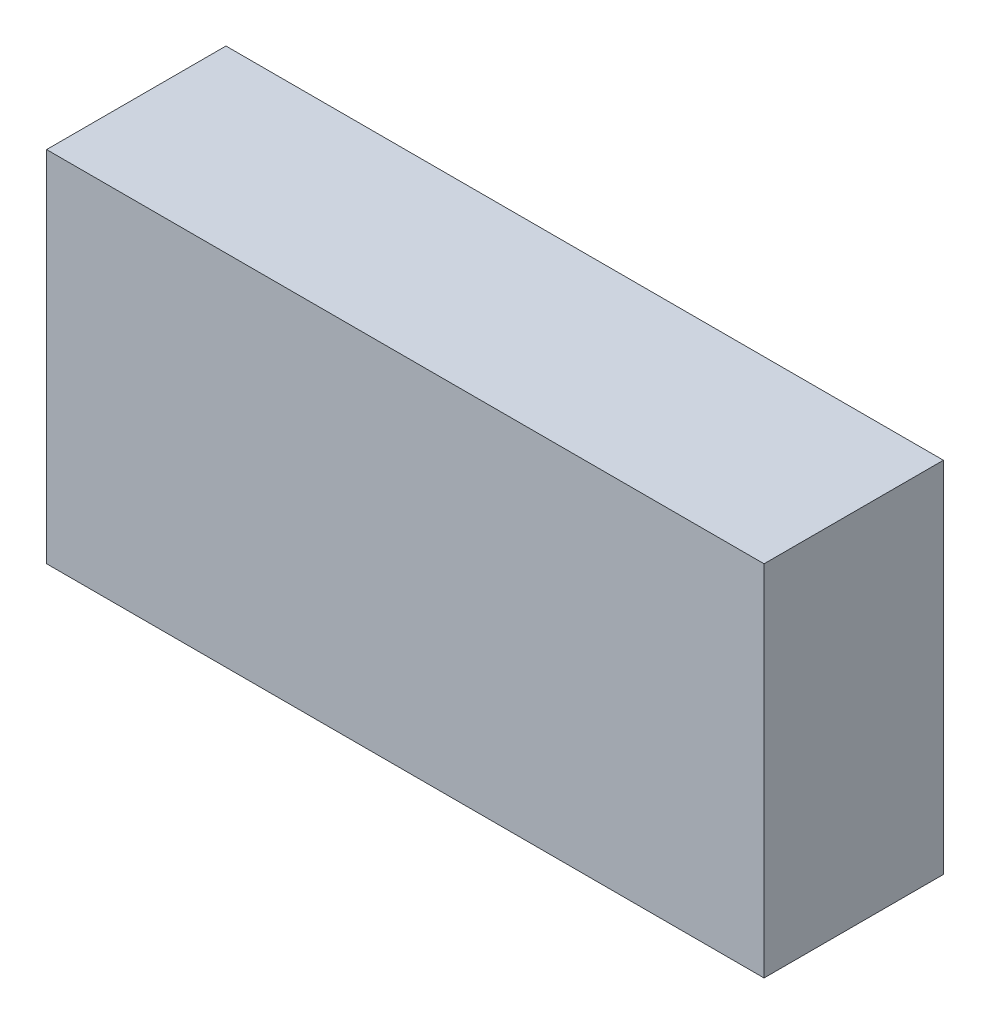
from build123d import *

# Parameters (mm, degrees)
SKETCH1_W               = 1.6000222
SKETCH1_H               = 0.7999984
COMPONENT_OUTLINE_DEPTH = 0.3999992


with BuildPart() as part:
    # Sketch1 → Component_Outline (new body)
    with BuildSketch(Plane.XY):
        with Locations((1.27e-05, 0)):
            Rectangle(SKETCH1_W, SKETCH1_H)
    extrude(amount=COMPONENT_OUTLINE_DEPTH)


solid = part.part
